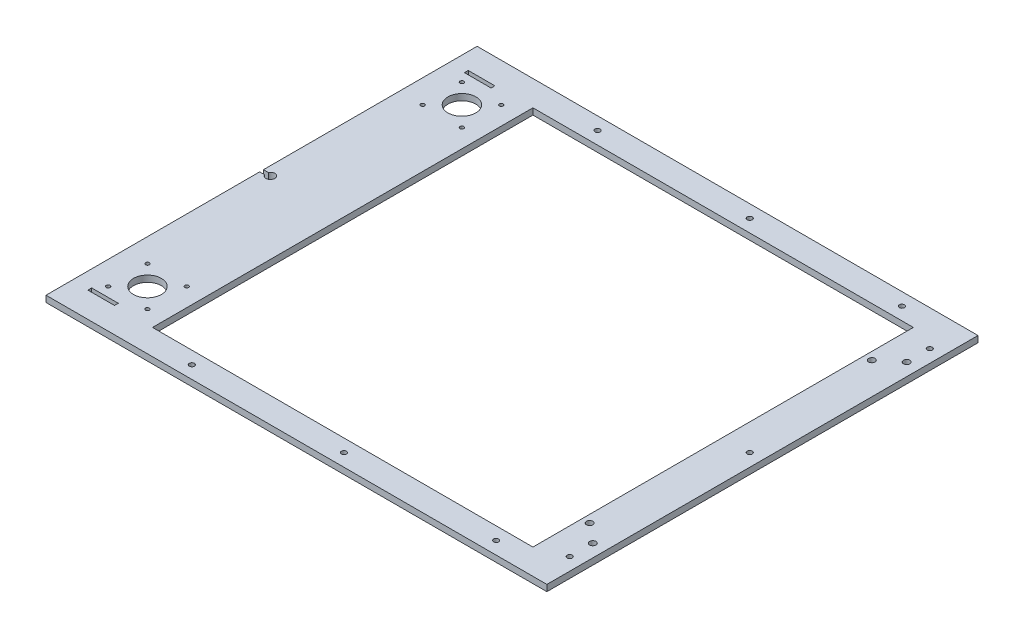
from build123d import *

# Parameters (mm, degrees)
SKETCH1_9_W         = 300
SKETCH1_9_H         = 300
SKETCH1_9_R         = 2
SKETCH1_9_R_2       = 2.5
SKETCH1_9_W_2       = 21
SKETCH1_9_H_2       = 3
SKETCH1_9_R_3       = 11
SKETCH1_9_R_4       = 1.5
BOSS_EXTRUDE7_DEPTH = 5


with BuildPart() as part:
    # Sketch1<9> → Boss-Extrude7 (new body)
    with BuildSketch(Plane(origin=(0, 0, 0), x_dir=(1, 0, 0), z_dir=(0, 1, 0))):
        with BuildLine():
            Line((170, 170), (-225, 170))
            Line((-225, 170), (-225, 1.5))
            Line((-225, 1.5), (-221.16227766, 1.5))
            ThreePointArc((-221.16227766, 1.5), (-214.5, 0), (-221.16227766, -1.5))
            Line((-221.16227766, -1.5), (-225, -1.5))
            Line((-225, -1.5), (-225, -170))
            Line((-225, -170), (170, -170))
            Line((170, -170), (170, 170))
        make_face()
        with Locations((-11, 0)):
            Rectangle(SKETCH1_9_W, SKETCH1_9_H, mode=Mode.SUBTRACT)
        with Locations((160, -142)):
            Circle(SKETCH1_9_R, mode=Mode.SUBTRACT)
        with Locations((160, -123.75)):
            Circle(SKETCH1_9_R_2, mode=Mode.SUBTRACT)
        with Locations((145, -111.25)):
            Circle(SKETCH1_9_R_2, mode=Mode.SUBTRACT)
        with Locations((160, 0)):
            Circle(SKETCH1_9_R, mode=Mode.SUBTRACT)
        with Locations((145, 111.25)):
            Circle(SKETCH1_9_R_2, mode=Mode.SUBTRACT)
        with Locations((160, 123.75)):
            Circle(SKETCH1_9_R_2, mode=Mode.SUBTRACT)
        with Locations((160, 142)):
            Circle(SKETCH1_9_R, mode=Mode.SUBTRACT)
        with Locations((120, -160)):
            Circle(SKETCH1_9_R, mode=Mode.SUBTRACT)
        with Locations((-120, -160)):
            Circle(SKETCH1_9_R, mode=Mode.SUBTRACT)
        with Locations((0, -160)):
            Circle(SKETCH1_9_R, mode=Mode.SUBTRACT)
        with Locations((120, 160)):
            Circle(SKETCH1_9_R, mode=Mode.SUBTRACT)
        with Locations((-120, 160)):
            Circle(SKETCH1_9_R, mode=Mode.SUBTRACT)
        with Locations((0, 160)):
            Circle(SKETCH1_9_R, mode=Mode.SUBTRACT)
        with Locations((-201.5, 148.5)):
            Rectangle(SKETCH1_9_W_2, SKETCH1_9_H_2, mode=Mode.SUBTRACT)
        with Locations((-201.5, -148.5)):
            Rectangle(SKETCH1_9_W_2, SKETCH1_9_H_2, mode=Mode.SUBTRACT)
        with Locations((-191, -124)):
            Circle(SKETCH1_9_R_3, mode=Mode.SUBTRACT)
        with Locations((-206.5, -108.5)):
            Circle(SKETCH1_9_R_4, mode=Mode.SUBTRACT)
        with Locations((-175.5, -108.5)):
            Circle(SKETCH1_9_R_4, mode=Mode.SUBTRACT)
        with Locations((-206.5, -139.5)):
            Circle(SKETCH1_9_R_4, mode=Mode.SUBTRACT)
        with Locations((-175.5, -139.5)):
            Circle(SKETCH1_9_R_4, mode=Mode.SUBTRACT)
        with Locations((-175.5, 139.5)):
            Circle(SKETCH1_9_R_4, mode=Mode.SUBTRACT)
        with Locations((-175.5, 108.5)):
            Circle(SKETCH1_9_R_4, mode=Mode.SUBTRACT)
        with Locations((-206.5, 139.5)):
            Circle(SKETCH1_9_R_4, mode=Mode.SUBTRACT)
        with Locations((-206.5, 108.5)):
            Circle(SKETCH1_9_R_4, mode=Mode.SUBTRACT)
        with Locations((-191, 124)):
            Circle(SKETCH1_9_R_3, mode=Mode.SUBTRACT)
    extrude(amount=BOSS_EXTRUDE7_DEPTH)


solid = part.part
